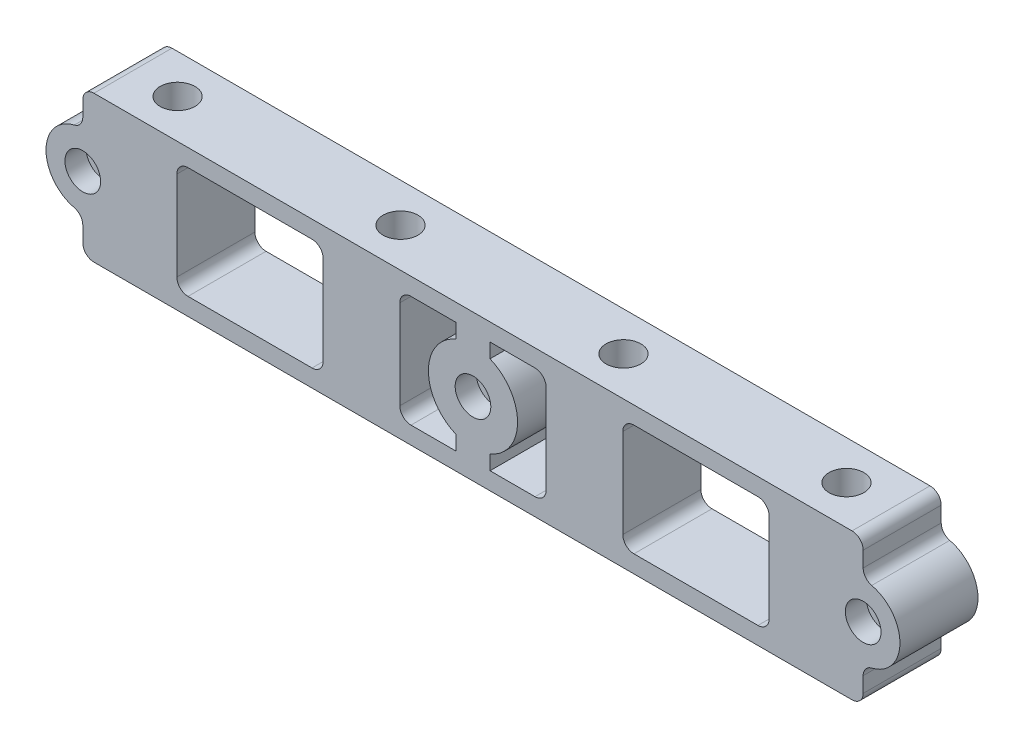
from build123d import *

# Parameters (mm, degrees)
SKETCH1_W           = 195.2625
SKETCH1_H           = 33.3375
SKETCH1_R           = 2.4892
BOSS_EXTRUDE1_DEPTH = 17.78
SKETCH2_R           = 3.96875
CUT_EXTRUDE1_DEPTH  = 33.3375
SKETCH3_R           = 4.064
CUT_EXTRUDE2_DEPTH  = 4.826
CUT_EXTRUDE3_DEPTH  = 17.78
FILLET1_R           = 2.54


with BuildPart() as part:
    # Sketch1 → Boss-Extrude1 (new body)
    with BuildSketch(Plane.XY):
        with Locations((-88.9, 0)):
            Rectangle(SKETCH1_W, SKETCH1_H)
        Circle(SKETCH1_R, mode=Mode.SUBTRACT)
        with Locations((-177.8, 0)):
            Circle(SKETCH1_R, mode=Mode.SUBTRACT)
        with Locations((-88.9, 0)):
            Circle(SKETCH1_R, mode=Mode.SUBTRACT)
    extrude(amount=-BOSS_EXTRUDE1_DEPTH)

    # Sketch2 → Cut-Extrude1 (cut)
    with BuildSketch(Plane(origin=(0, 16.66875, 0), x_dir=(1, 0, 0), z_dir=(0, 1, 0))):
        with Locations(Location((-12.7, 8.89, 0), (0, 0, 270))):
            Circle(SKETCH2_R)
        with Locations(Location((-63.5, 8.89, 0), (0, 0, 270))):
            Circle(SKETCH2_R)
        with Locations(Location((-114.3, 8.89, 0), (0, 0, 270))):
            Circle(SKETCH2_R)
        with Locations(Location((-165.1, 8.89, 0), (0, 0, 270))):
            Circle(SKETCH2_R)
    extrude(amount=-CUT_EXTRUDE1_DEPTH, mode=Mode.SUBTRACT)

    # Sketch3 → Cut-Extrude2 (cut)
    with BuildSketch(Plane.XY):
        Circle(SKETCH3_R)
        with Locations((-88.9, 0)):
            Circle(SKETCH3_R)
        with Locations((-177.8, 0)):
            Circle(SKETCH3_R)
    extrude(amount=-CUT_EXTRUDE2_DEPTH, mode=Mode.SUBTRACT)

    # Sketch5 → Cut-Extrude3 (cut)
    with BuildSketch(Plane.XY):
        with BuildLine():
            Line((0, -16.66875), (8.73125, -16.66875))
            Line((8.73125, -16.66875), (8.73125, 16.66875))
            Line((8.73125, 16.66875), (0, 16.66875))
            Line((0, 16.66875), (0, 10.622546022))
            ThreePointArc((0, 10.622546022), (0.546012526, 9.049137635), (1.949302326, 8.152186482))
            ThreePointArc((1.949302326, 8.152186482), (8.382, 0), (1.949302326, -8.152186482))
            ThreePointArc((1.949302326, -8.152186482), (0.546012526, -9.049137635), (0, -10.622546022))
            Line((0, -10.622546022), (0, -16.66875))
        make_face()
        with BuildLine():
            Line((-23.97125, -12.7), (-52.22875, -12.7))
            ThreePointArc((-52.22875, -12.7), (-54.024801224, -11.956051224), (-54.76875, -10.16))
            Line((-54.76875, -10.16), (-54.76875, 10.16))
            ThreePointArc((-54.76875, 10.16), (-54.024801224, 11.956051224), (-52.22875, 12.7))
            Line((-52.22875, 12.7), (-23.97125, 12.7))
            ThreePointArc((-23.97125, 12.7), (-22.175198776, 11.956051224), (-21.43125, 10.16))
            Line((-21.43125, 10.16), (-21.43125, -10.16))
            ThreePointArc((-21.43125, -10.16), (-22.175198776, -11.956051224), (-23.97125, -12.7))
        make_face()
        with BuildLine():
            Line((-85.011936327, -9.38661605), (-85.011936327, -12.7))
            Line((-85.011936327, -12.7), (-74.77125, -12.7))
            ThreePointArc((-74.77125, -12.7), (-72.975198776, -11.956051224), (-72.23125, -10.16))
            Line((-72.23125, -10.16), (-72.23125, 10.16))
            ThreePointArc((-72.23125, 10.16), (-72.975198776, 11.956051224), (-74.77125, 12.7))
            Line((-74.77125, 12.7), (-85.011936327, 12.7))
            Line((-85.011936327, 12.7), (-85.011936327, 9.38661605))
            ThreePointArc((-85.011936327, 9.38661605), (-78.74, 0), (-85.011936327, -9.38661605))
        make_face()
        with BuildLine():
            Line((-103.02875, 12.7), (-92.788063673, 12.7))
            Line((-92.788063673, 12.7), (-92.788063673, 9.38661605))
            ThreePointArc((-92.788063673, 9.38661605), (-99.06, 0), (-92.788063673, -9.38661605))
            Line((-92.788063673, -9.38661605), (-92.788063673, -12.7))
            Line((-92.788063673, -12.7), (-103.02875, -12.7))
            ThreePointArc((-103.02875, -12.7), (-104.824801224, -11.956051224), (-105.56875, -10.16))
            Line((-105.56875, -10.16), (-105.56875, 10.16))
            ThreePointArc((-105.56875, 10.16), (-104.824801224, 11.956051224), (-103.02875, 12.7))
        make_face()
        with BuildLine():
            Line((-153.82875, 12.7), (-125.57125, 12.7))
            ThreePointArc((-125.57125, 12.7), (-123.775198776, 11.956051224), (-123.03125, 10.16))
            Line((-123.03125, 10.16), (-123.03125, -10.16))
            ThreePointArc((-123.03125, -10.16), (-123.775198776, -11.956051224), (-125.57125, -12.7))
            Line((-125.57125, -12.7), (-153.82875, -12.7))
            ThreePointArc((-153.82875, -12.7), (-155.624801224, -11.956051224), (-156.36875, -10.16))
            Line((-156.36875, -10.16), (-156.36875, 10.16))
            ThreePointArc((-156.36875, 10.16), (-155.624801224, 11.956051224), (-153.82875, 12.7))
        make_face()
        with BuildLine():
            Line((-186.53125, -16.66875), (-186.53125, 16.66875))
            Line((-186.53125, 16.66875), (-177.8, 16.66875))
            Line((-177.8, 16.66875), (-177.8, 10.622546022))
            ThreePointArc((-177.8, 10.622546022), (-178.346012526, 9.049137635), (-179.749302326, 8.152186482))
            ThreePointArc((-179.749302326, 8.152186482), (-186.182, 0), (-179.749302326, -8.152186482))
            ThreePointArc((-179.749302326, -8.152186482), (-178.346012526, -9.049137635), (-177.8, -10.622546022))
            Line((-177.8, -10.622546022), (-177.8, -16.66875))
            Line((-177.8, -16.66875), (-186.53125, -16.66875))
        make_face()
    extrude(amount=-CUT_EXTRUDE3_DEPTH, mode=Mode.SUBTRACT)

    # Fillet1
    fillet1_edges = [part.edges().sort_by_distance(p)[0] for p in [
        (0, 16.66875, -8.89),
        (0, -16.66875, -8.89),
        (-177.8, -16.66875, -8.89),
        (-177.8, 16.66875, -8.89),
    ]]
    fillet(fillet1_edges, radius=FILLET1_R)


solid = part.part
